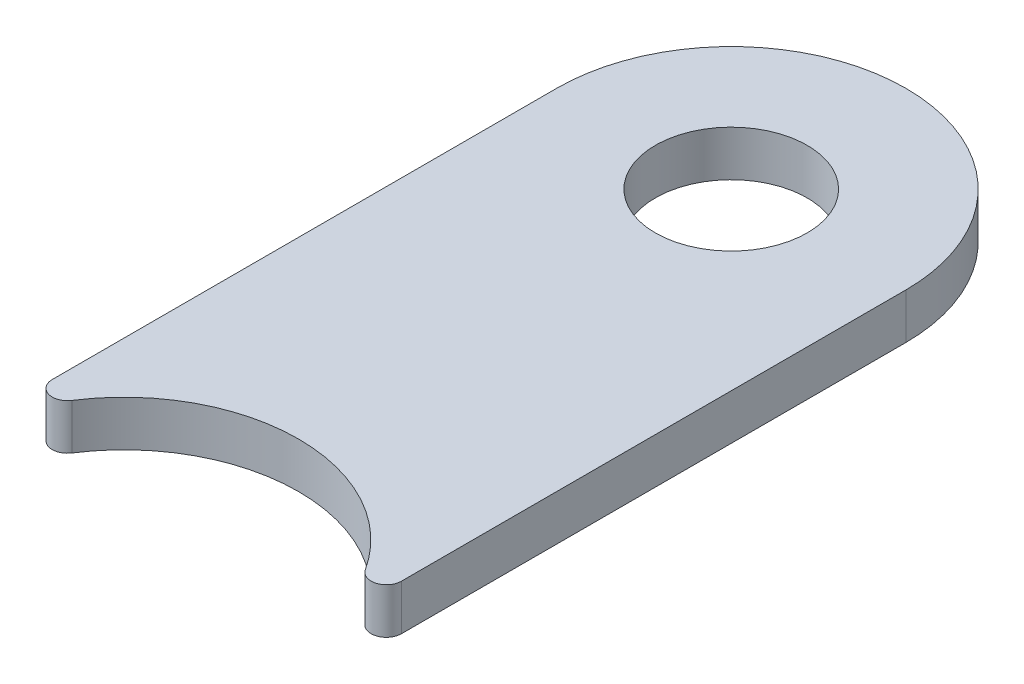
from build123d import *

# Parameters (mm, degrees)
SKETCH1_R           = 11.500000000000005
SKETCH1_R_2         = 5
BOSS_EXTRUDE1_DEPTH = 3
FILLET1_R           = 1


with BuildPart() as part:
    # Sketch1 → Boss-Extrude1 (new body)
    # profile 1 of 2: a face of its own
    with BuildSketch(Plane(origin=(0, 0, 0), x_dir=(1, 0, 0), z_dir=(0, 1, 0))):
        with BuildLine():
            ThreePointArc((11.500000000000005, 40), (-2.11e-15, 28.499999999999993), (-11.500000000000005, 40))
            Line((-11.500000000000002, 40), (-11.5, 0))
            ThreePointArc((-11.5, 1.41e-15), (7e-16, 11.5), (11.5, 0))
            Line((11.5, 0), (11.500000000000002, 40))
        make_face()
    # profile 2 of 2: a face of its own
    with BuildSketch(Plane(origin=(0, 0, 0), x_dir=(1, 0, 0), z_dir=(0, 1, 0))):
        with Locations((0, 40)):
            Circle(SKETCH1_R)
        with Locations(Location((0, 40, 0), (0, 0, 270))):
            Circle(SKETCH1_R_2, mode=Mode.SUBTRACT)
    extrude(amount=BOSS_EXTRUDE1_DEPTH)

    # Fillet1
    fillet1_edges = [part.edges().sort_by_distance(p)[0] for p in [
        (11.5, 1.5, -1.22e-15),
        (-11.5, 1.5, -7e-16),
    ]]
    fillet(fillet1_edges, radius=FILLET1_R)


solid = part.part
